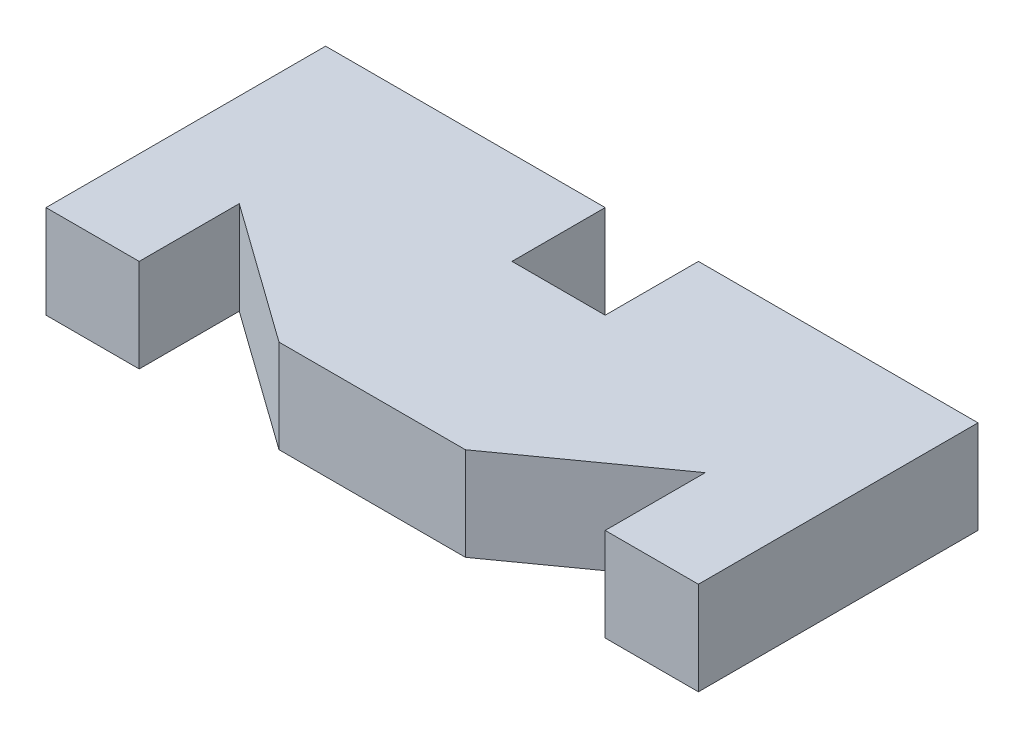
from build123d import *

# Parameters (mm, degrees)
BOSS_EXTRUDE1_DEPTH = 10


with BuildPart() as part:
    # Sketch1 → Boss-Extrude1 (new body)
    with BuildSketch(Plane(origin=(0, 0, 0), x_dir=(1, 0, 0), z_dir=(0, 1, 0))):
        Polygon((-35, 15), (-35, -15), (-25, -15), (-25, -4.26397879), (-10, -15), (10, -15), (25, -4.26397879), (25, -15), (35, -15), (35, 15), (5, 15), (5, 5), (-5, 5), (-5, 15), align=None)
    extrude(amount=BOSS_EXTRUDE1_DEPTH)


solid = part.part
